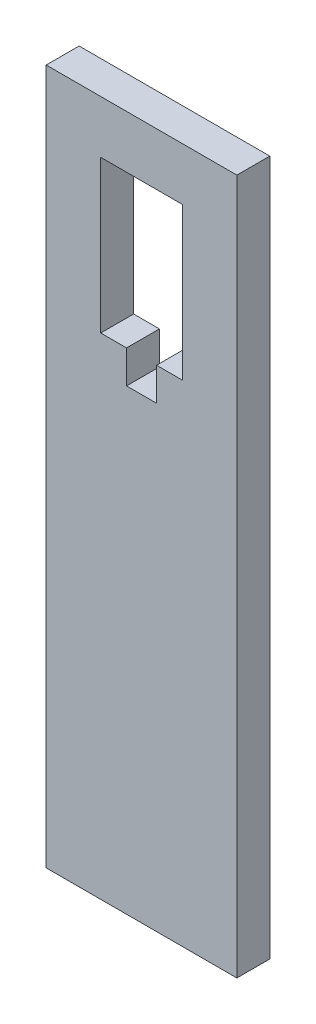
from build123d import *

# Parameters (mm, degrees)
SKETCH1_W           = 28.96
SKETCH1_H           = 74.5
BOSS_EXTRUDE1_DEPTH = 5
SKETCH2_W           = 8.28
SKETCH2_H           = 5
BOSS_EXTRUDE2_DEPTH = 23.11
SKETCH3_W           = 28.96
SKETCH3_H           = 5
BOSS_EXTRUDE3_DEPTH = 8
SKETCH4_W           = 4.56
SKETCH4_H           = 5
CUT_EXTRUDE1_DEPTH  = 5


with BuildPart() as part:
    # Sketch1 → Boss-Extrude1 (new body)
    with BuildSketch(Plane.XY):
        with Locations((-4.078230088, -6.160265487)):
            Rectangle(SKETCH1_W, SKETCH1_H)
    extrude(amount=BOSS_EXTRUDE1_DEPTH)

    # Sketch2 → Boss-Extrude2 (add)
    with BuildSketch(Plane(origin=(0, 31.089734513, 0), x_dir=(1, 0, 0), z_dir=(0, 1, 0))):
        with Locations((-14.418230088, -2.5)):
            Rectangle(SKETCH2_W, SKETCH2_H)
        with Locations((6.261769912, -2.5)):
            Rectangle(SKETCH2_W, SKETCH2_H)
    extrude(amount=BOSS_EXTRUDE2_DEPTH)

    # Sketch3 → Boss-Extrude3 (add)
    with BuildSketch(Plane(origin=(0, 54.199734513, 0), x_dir=(1, 0, 0), z_dir=(0, 1, 0))):
        with Locations((-4.078230088, -2.5)):
            Rectangle(SKETCH3_W, SKETCH3_H)
    extrude(amount=BOSS_EXTRUDE3_DEPTH)

    # Sketch4 → Cut-Extrude1 (cut)
    with BuildSketch(Plane(origin=(0, 31.089734513, 0), x_dir=(1, 0, 0), z_dir=(0, 1, 0))):
        with Locations((-4.078230088, -2.5)):
            Rectangle(SKETCH4_W, SKETCH4_H)
    extrude(amount=-CUT_EXTRUDE1_DEPTH, mode=Mode.SUBTRACT)


solid = part.part
